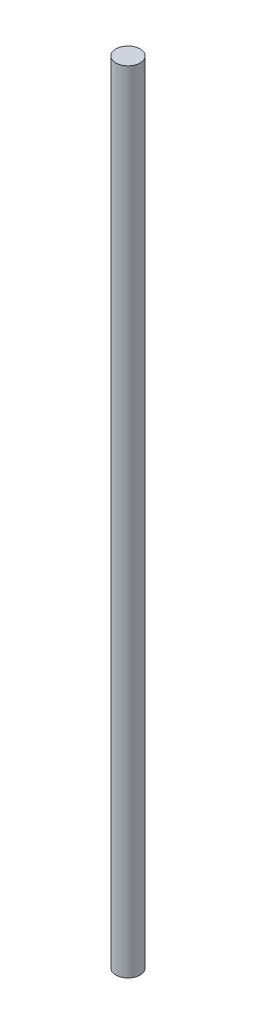
from build123d import *

# Parameters (mm, degrees)
PACK_BILYALI_VIDA_1605_START = 380
SKETCH1_R                    = 8
PACK_BILYALI_VIDA_1605_DEPTH = 520


with BuildPart() as part:
    # Sketch1 → PACK_bilyali_vida_1605 (new body)
    with BuildSketch(Plane(origin=(0, 0, 0), x_dir=(1, 0, 0), z_dir=(0, 1, 0)).offset(PACK_BILYALI_VIDA_1605_START)):
        with Locations(Location((350, 400, 0), (0, 0, 270))):
            Circle(SKETCH1_R)
    extrude(amount=PACK_BILYALI_VIDA_1605_DEPTH)


solid = part.part
